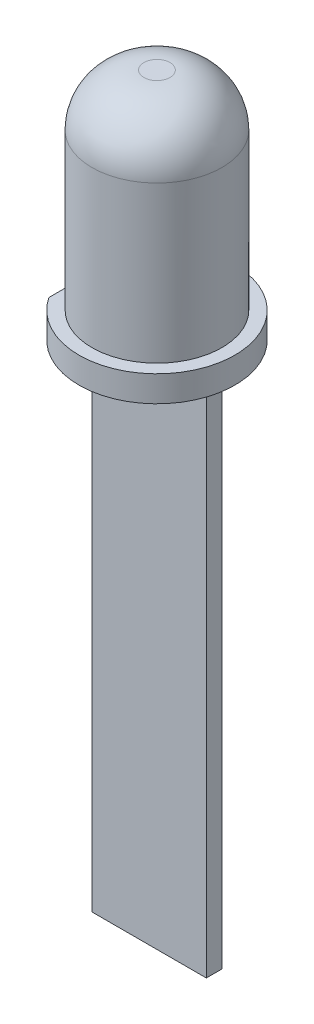
from build123d import *

# Parameters (mm, degrees)
SKETCH1_R           = 3
BOSS_EXTRUDE1_DEPTH = 1
SKETCH2_R           = 2.5
BOSS_EXTRUDE2_DEPTH = 8
FILLET1_R           = 2
SKETCH3_W           = 4.4
SKETCH3_H           = 0.6
BOSS_EXTRUDE3_DEPTH = 20
CUT_EXTRUDE1_START  = -2.5
SKETCH4_W           = 14.899802266
SKETCH4_H           = 5.02411501
CUT_EXTRUDE1_DEPTH  = 20


with BuildPart() as part:
    # Sketch1 → Boss-Extrude1 (new body)
    with BuildSketch(Plane(origin=(0, 0, 0), x_dir=(1, 0, 0), z_dir=(0, 1, 0))):
        with Locations(Location((0, 0, 0), (0, 0, 270))):
            Circle(SKETCH1_R)
    extrude(amount=BOSS_EXTRUDE1_DEPTH)

    # Sketch2 → Boss-Extrude2 (add)
    with BuildSketch(Plane(origin=(0, 1, 0), x_dir=(1, 0, 0), z_dir=(0, 1, 0))):
        with Locations(Location((0, 0, 0), (0, 0, 270))):
            Circle(SKETCH2_R)
    extrude(amount=BOSS_EXTRUDE2_DEPTH)

    # Fillet1
    fillet1_edges = [part.edges().sort_by_distance(p)[0] for p in [
        (0, 9, -2.5),
    ]]
    fillet(fillet1_edges, radius=FILLET1_R)

    # Sketch3 → Boss-Extrude3 (add)
    with BuildSketch(Plane.XZ):
        Rectangle(SKETCH3_W, SKETCH3_H)
    extrude(amount=BOSS_EXTRUDE3_DEPTH)

    # Sketch4 → Cut-Extrude1 (cut)
    with BuildSketch(Plane(origin=(0, 0, 0), x_dir=(0, 0, -1), z_dir=(1, 0, 0)).offset(CUT_EXTRUDE1_START)):
        Rectangle(SKETCH4_W, SKETCH4_H)
    extrude(amount=-CUT_EXTRUDE1_DEPTH, mode=Mode.SUBTRACT)


solid = part.part
